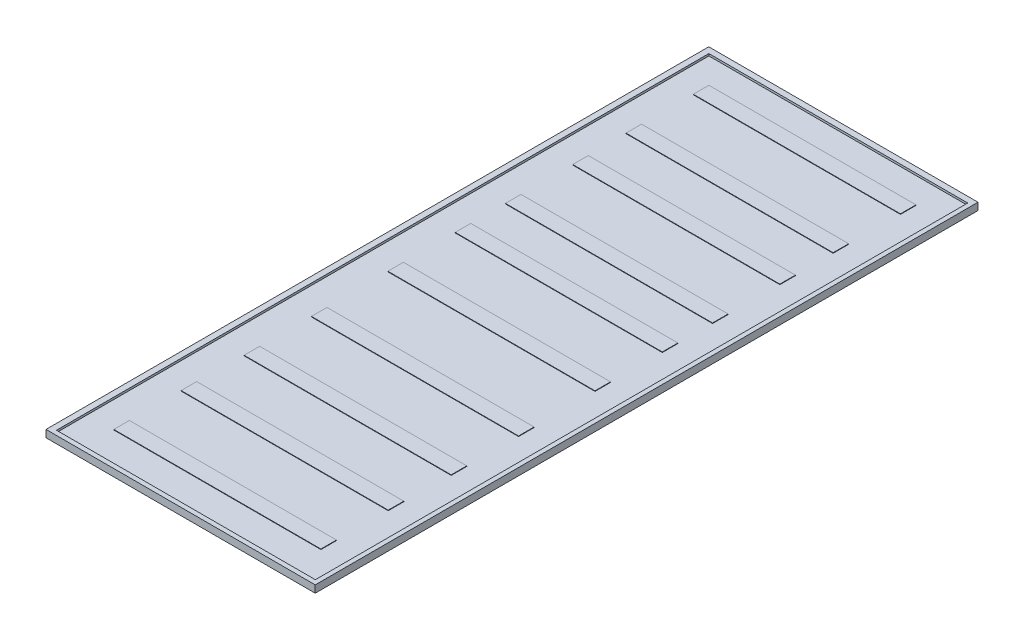
from build123d import *

# Parameters (mm, degrees)
SKETCH1_W            = 50
SKETCH1_H            = 126
BOSS_EXTRUDE1_DEPTH  = 0.99736772
SKETCH2_W            = 40
SKETCH2_H            = 3
BOSS_EXTRUDE2_DEPTH  = 0.1
SKETCH6_W            = 52
SKETCH6_H            = 128
SKETCH6_W_2          = 50
SKETCH6_H_2          = 126
BOSS_EXTRUDE8_DEPTH  = 1.4
SKETCH11_W           = 40
SKETCH11_H           = 3
BOSS_EXTRUDE12_DEPTH = 0.1
SKETCH12_W           = 40
SKETCH12_H           = 3
BOSS_EXTRUDE13_DEPTH = 0.1
SKETCH13_W           = 40
SKETCH13_H           = 3
BOSS_EXTRUDE14_DEPTH = 0.1
SKETCH14_W           = 40
SKETCH14_H           = 3
BOSS_EXTRUDE15_DEPTH = 0.1


with BuildPart() as part:
    # Sketch1 → Boss-Extrude1 (new body)
    with BuildSketch(Plane(origin=(0, 0, 0), x_dir=(1, 0, 0), z_dir=(0, 1, 0))):
        with Locations((-71.774193548, -38.230414747)):
            Rectangle(SKETCH1_W, SKETCH1_H)
    extrude(amount=BOSS_EXTRUDE1_DEPTH)

    # Sketch2 → Boss-Extrude2 (add)
    with BuildSketch(Plane(origin=(0, 0.99736772, 0), x_dir=(1, 0, 0), z_dir=(0, 1, 0))):
        with Locations((-71.774193548, 18.269585253)):
            Rectangle(SKETCH2_W, SKETCH2_H)
        with Locations((-71.774193548, 5.269585253)):
            Rectangle(SKETCH2_W, SKETCH2_H)
    extrude(amount=BOSS_EXTRUDE2_DEPTH)

    # Sketch6 → Boss-Extrude8 (add)
    with BuildSketch(Plane(origin=(0, 0, 0), x_dir=(1, 0, 0), z_dir=(0, 1, 0))):
        with Locations((-71.921181358, -38.105868157)):
            Rectangle(SKETCH6_W, SKETCH6_H)
        with Locations((-71.774193548, -38.230414747)):
            Rectangle(SKETCH6_W_2, SKETCH6_H_2, mode=Mode.SUBTRACT)
    extrude(amount=BOSS_EXTRUDE8_DEPTH)

    # Sketch11 → Boss-Extrude12 (add)
    with BuildSketch(Plane(origin=(0, 0.99736772, 0), x_dir=(1, 0, 0), z_dir=(0, 1, 0))):
        with Locations((-71.666893543, -5.127021843)):
            Rectangle(SKETCH11_W, SKETCH11_H)
        with Locations((-71.666893543, -18.127021843)):
            Rectangle(SKETCH11_W, SKETCH11_H)
    extrude(amount=BOSS_EXTRUDE12_DEPTH)

    # Sketch12 → Boss-Extrude13 (add)
    with BuildSketch(Plane(origin=(0, 0.99736772, -2.5), x_dir=(1, 0, 0), z_dir=(0, 1, 0))):
        with Locations((-71.666893543, -30.328159375)):
            Rectangle(SKETCH12_W, SKETCH12_H)
        with Locations((-71.666893543, -43.328159375)):
            Rectangle(SKETCH12_W, SKETCH12_H)
    extrude(amount=BOSS_EXTRUDE13_DEPTH)

    # Sketch13 → Boss-Extrude14 (add)
    with BuildSketch(Plane(origin=(0, 0.99736772, 0), x_dir=(1, 0, 0), z_dir=(0, 1, 0))):
        with Locations((-71.498865442, -55.766480825)):
            Rectangle(SKETCH13_W, SKETCH13_H)
        with Locations((-71.498865442, -68.766480825)):
            Rectangle(SKETCH13_W, SKETCH13_H)
    extrude(amount=BOSS_EXTRUDE14_DEPTH)

    # Sketch14 → Boss-Extrude15 (add)
    with BuildSketch(Plane(origin=(0, 0.99736772, 0), x_dir=(1, 0, 0), z_dir=(0, 1, 0))):
        with Locations((-71.677348389, -80.754093343)):
            Rectangle(SKETCH14_W, SKETCH14_H)
        with Locations((-71.677348389, -93.754093343)):
            Rectangle(SKETCH14_W, SKETCH14_H)
    extrude(amount=BOSS_EXTRUDE15_DEPTH)


solid = part.part
